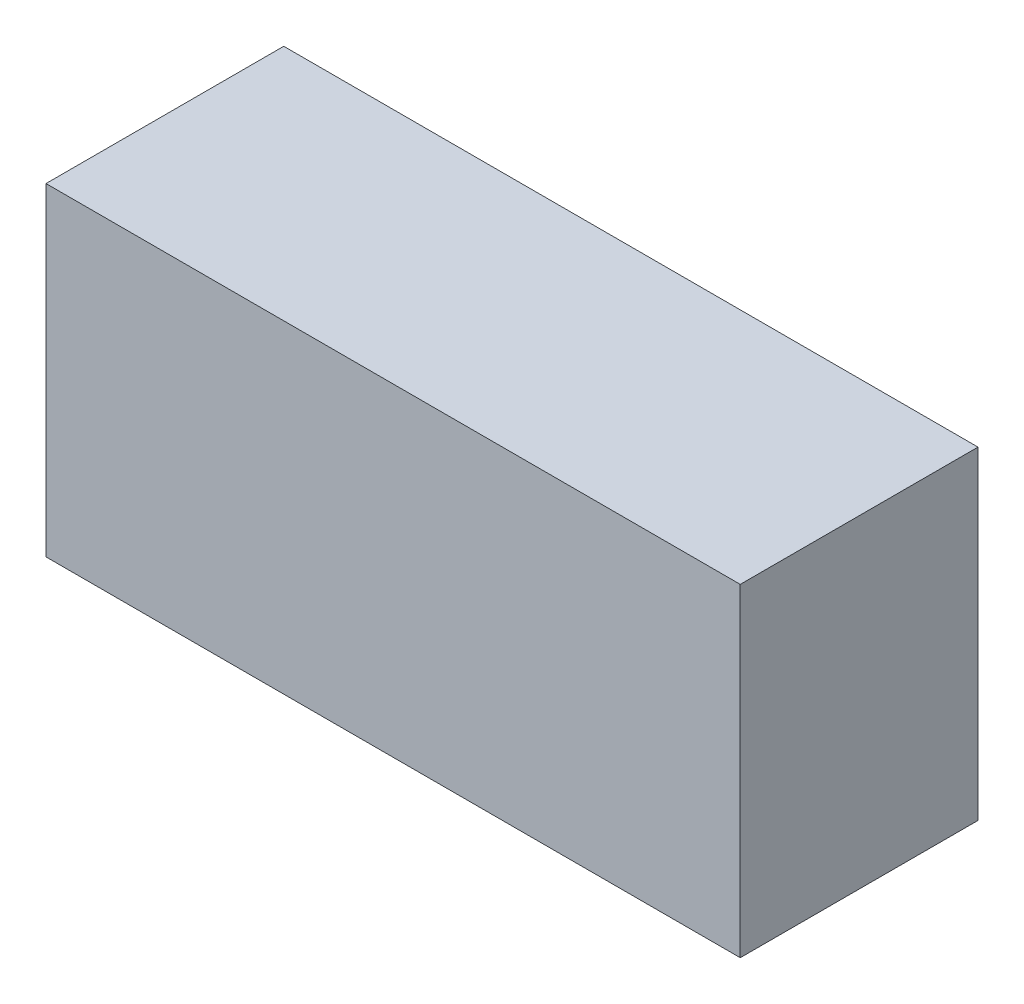
from build123d import *

# Parameters (mm, degrees)
SKETCH1_W           = 73
SKETCH1_H           = 25
BOSS_EXTRUDE1_DEPTH = 34


with BuildPart() as part:
    # Sketch1 → Boss-Extrude1 (new body)
    with BuildSketch(Plane(origin=(0, 0, 0), x_dir=(1, 0, 0), z_dir=(0, 1, 0))):
        Rectangle(SKETCH1_W, SKETCH1_H)
    extrude(amount=BOSS_EXTRUDE1_DEPTH)


solid = part.part
